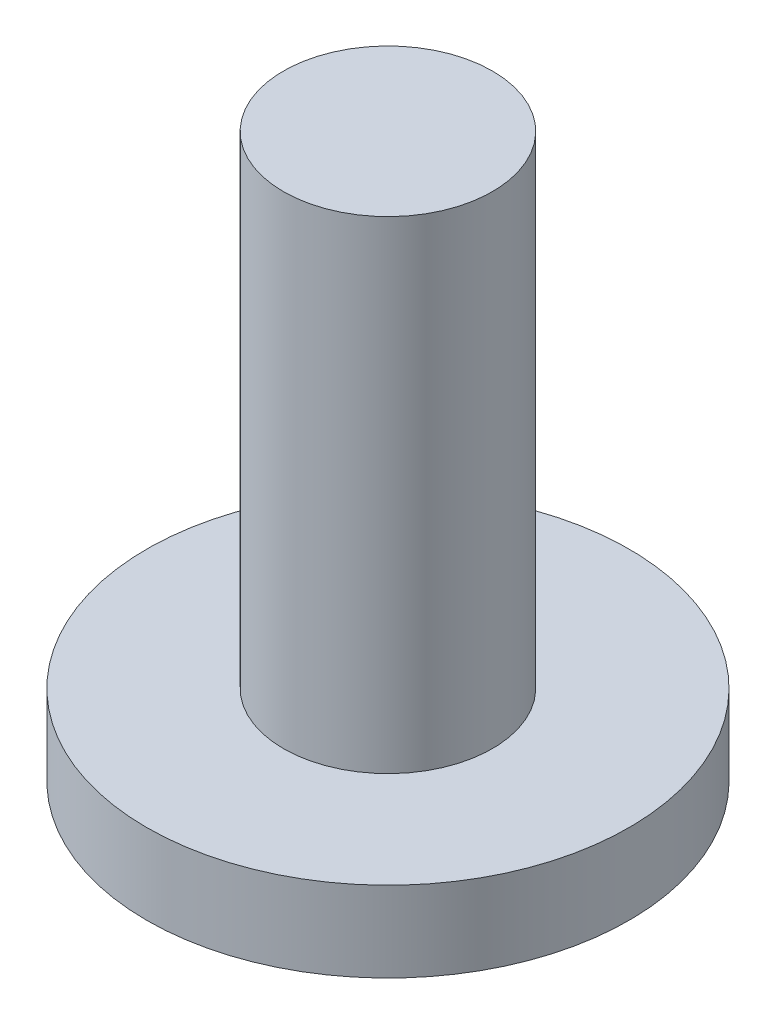
from build123d import *

# Parameters (mm, degrees)
SKETCH1_R           = 3
BOSS_EXTRUDE1_DEPTH = 1
SKETCH2_R           = 1.3
BOSS_EXTRUDE2_DEPTH = 6


with BuildPart() as part:
    # Sketch1 → Boss-Extrude1 (new body)
    with BuildSketch(Plane(origin=(0, 0, 0), x_dir=(1, 0, 0), z_dir=(0, 1, 0))):
        with Locations(Location((0, 0, 0), (0, 0, 270))):
            Circle(SKETCH1_R)
    extrude(amount=BOSS_EXTRUDE1_DEPTH)

    # Sketch2 → Boss-Extrude2 (add)
    with BuildSketch(Plane(origin=(0, 1, 0), x_dir=(1, 0, 0), z_dir=(0, 1, 0))):
        with Locations(Location((0, 0, 0), (0, 0, 270))):
            Circle(SKETCH2_R)
    extrude(amount=BOSS_EXTRUDE2_DEPTH)


solid = part.part
